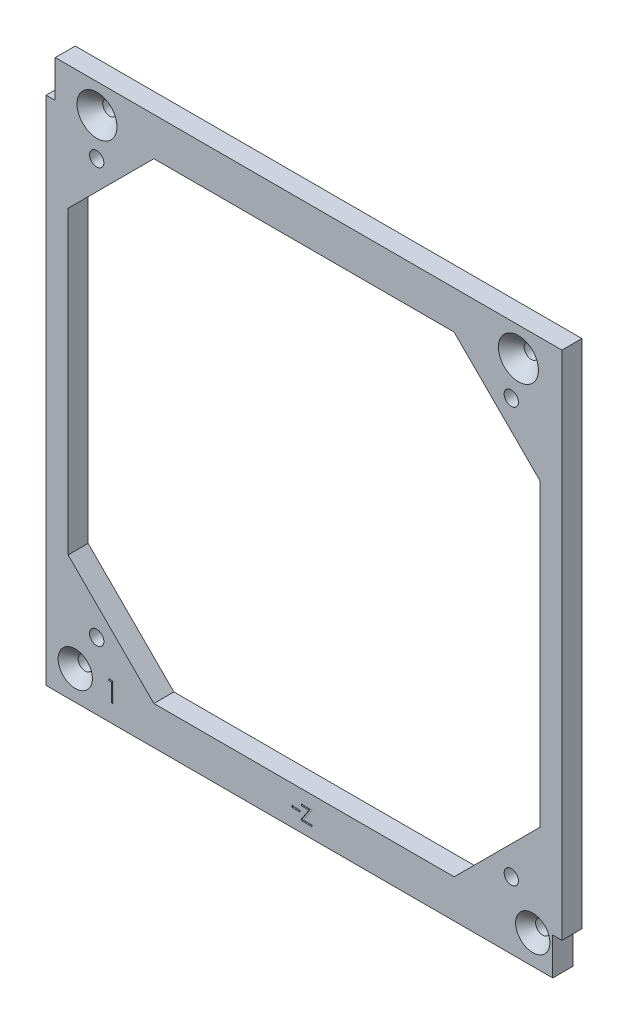
from build123d import *

# Parameters (mm, degrees)
ESBO_O1_W                  = 90.2
ESBO_O1_H                  = 95.9
RESSALTO_EXTRUS_O1_DEPTH   = 3.5
ESBO_O2_R                  = 1.25
CORTE_EXTRUS_O1_DEPTH      = 5
CORTE_EXTRUS_O3_DEPTH      = 5
ESBO_O4_R                  = 1.25
CORTE_EXTRUS_O2_DEPTH      = 10
CHANFRO4_SIZE              = 1.75
CHANFRO5_SIZE              = 1.75
CHANFRO6_SIZE              = 2.25
CHANFRO7_SIZE              = 2.25
CORTE_EXTRUS_O4_DEPTH      = 0.2
CORTE_EXTRUS_O5_DEPTH      = 0.2
CORTE_EXTRUS_O7_DEPTH      = 66.920122118
CORTE_EXTRUS_O7_DEPTH_BACK = 5
ESBO_O7_W                  = 1.6
ESBO_O7_H                  = 6.5
CORTE_EXTRUS_O8_DEPTH      = 5
ESBO_O9_W                  = 1.346153846
ESBO_O9_H                  = 0.358974359
CORTE_EXTRUS_O9_DEPTH      = 0.2


with BuildPart() as part:
    # Esboço1 → Ressalto-extrusão1 (new body)
    with BuildSketch(Plane.XY):
        Rectangle(ESBO_O1_W, ESBO_O1_H)
    extrude(amount=RESSALTO_EXTRUS_O1_DEPTH)

    # Esboço2 → Corte-extrusão1 (cut)
    with BuildSketch(Plane.XY):
        with Locations((-36.2, 42.85)):
            Circle(ESBO_O2_R)
        with Locations((37.5, 42.85)):
            Circle(ESBO_O2_R)
        with Locations((40, -42.85)):
            Circle(ESBO_O2_R)
        with Locations((-40, -42.85)):
            Circle(ESBO_O2_R)
    extrude(amount=CORTE_EXTRUS_O1_DEPTH, mode=Mode.SUBTRACT)

    # Esboço3 → Corte-extrusão3 (cut)
    with BuildSketch(Plane.XY):
        Polygon((-26.25, 41.25), (26.25, 41.25), (41.25, 26.25), (41.25, -26.25), (26.25, -41.25), (-26.25, -41.25), (-41.25, -26.25), (-41.25, 26.25), align=None)
    extrude(amount=CORTE_EXTRUS_O3_DEPTH, mode=Mode.SUBTRACT)

    # Esboço4 → Corte-extrusão2 (cut)
    with BuildSketch(Plane.XY):
        with Locations((-36.25, 36.25)):
            Circle(ESBO_O4_R)
        with Locations((36.25, 36.25)):
            Circle(ESBO_O4_R)
        with Locations((-36.25, -36.25)):
            Circle(ESBO_O4_R)
        with Locations((36.25, -36.25)):
            Circle(ESBO_O4_R)
    extrude(amount=CORTE_EXTRUS_O2_DEPTH, mode=Mode.SUBTRACT)

    # Chanfro4
    chanfro4_edges = [part.edges().sort_by_distance(p)[0] for p in [
        (-41.25, -42.85, 3.5),
    ]]
    chamfer(chanfro4_edges, length=CHANFRO4_SIZE)

    # Chanfro5
    chanfro5_edges = [part.edges().sort_by_distance(p)[0] for p in [
        (38.75, -42.85, 3.5),
    ]]
    chamfer(chanfro5_edges, length=CHANFRO5_SIZE)

    # Chanfro6
    chanfro6_edges = [part.edges().sort_by_distance(p)[0] for p in [
        (-37.45, 42.85, 3.5),
    ]]
    chamfer(chanfro6_edges, length=CHANFRO6_SIZE)

    # Chanfro7
    chanfro7_edges = [part.edges().sort_by_distance(p)[0] for p in [
        (36.25, 42.85, 3.5),
    ]]
    chamfer(chanfro7_edges, length=CHANFRO7_SIZE)

    # Esboço5 → Corte-extrusão4 (cut)
    with BuildSketch(Plane.XY.offset(3.5)):
        Polygon((-34.011664728, -41.359633286), (-33.364529311, -41.359633286), (-33.364529311, -44.859633286), (-33.678631875, -44.859633286), (-33.678631875, -41.718607645), (-34.217093414, -41.718607645), align=None)
    extrude(amount=-CORTE_EXTRUS_O4_DEPTH, mode=Mode.SUBTRACT)

    # Esboço6 → Corte-extrusão5 (cut)
    with BuildSketch(Plane(origin=(0, 0, 0), x_dir=(-1, 0, 0), z_dir=(0, 0, -1))):
        Polygon((33.93825461, -40.504659527), (34.585390027, -40.504659527), (34.585390027, -44.004659527), (34.271287463, -44.004659527), (34.271287463, -40.863633886), (33.732825924, -40.863633886), align=None)
    extrude(amount=-CORTE_EXTRUS_O5_DEPTH, mode=Mode.SUBTRACT)

    # Esboço7 → Corte-extrusão7 (cut, two sides: drawn at the far end of the back side and taken through both)
    with BuildSketch(Plane(origin=(0, 0, 0), x_dir=(-1, 0, 0), z_dir=(0, 0, -1)).offset(-CORTE_EXTRUS_O7_DEPTH_BACK)):
        with Locations((-44.3, -44.7)):
            Rectangle(ESBO_O7_W, ESBO_O7_H)
    extrude(amount=CORTE_EXTRUS_O7_DEPTH + CORTE_EXTRUS_O7_DEPTH_BACK, mode=Mode.SUBTRACT)

    # Esboço8 → Corte-extrusão8 (cut)
    with BuildSketch(Plane.XY.offset(3.5)):
        Polygon((-43.5, 47.95), (-43.5, 41.45), (-45.1, 41.45), (-45.287231685, 41.45), (-45.287231685, 48.410891955), (-43.5, 48.410891955), align=None)
    extrude(amount=-CORTE_EXTRUS_O8_DEPTH, mode=Mode.SUBTRACT)

    # Esboço9 → Corte-extrusão9 (cut)
    with BuildSketch(Plane.XY.offset(3.5)):
        with Locations((-1.407956652, -44.741681875)):
            Rectangle(ESBO_O9_W, ESBO_O9_H)
        Polygon((-0.46564896, -43.530143413), (1.46383822, -43.530143413), (-0.023942229, -45.773733157), (1.418966425, -45.773733157), (1.418966425, -46.087835721), (-0.600264345, -46.087835721), (0.888217226, -43.844245977), (-0.46564896, -43.844245977), align=None)
    extrude(amount=-CORTE_EXTRUS_O9_DEPTH, mode=Mode.SUBTRACT)


solid = part.part
